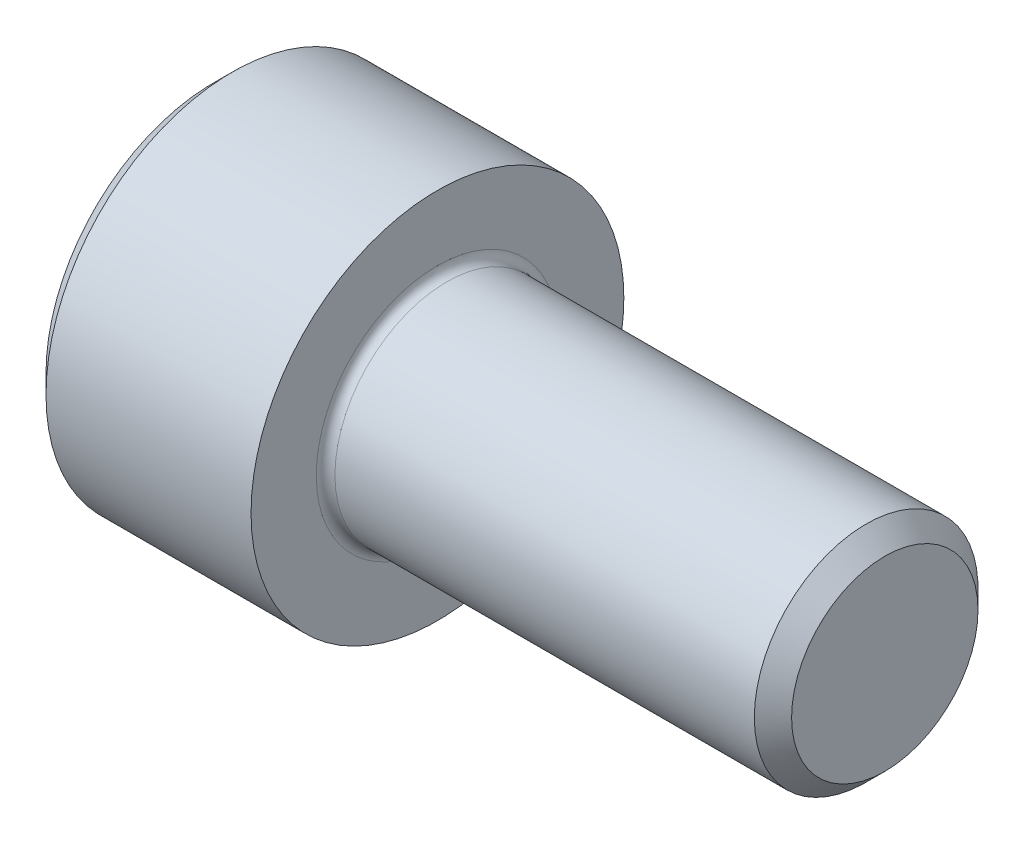
from build123d import *

# Parameters (mm, degrees)
CHAMFER1_SIZE      = 0.5
CUT_EXTRUDE1_DEPTH = 3


with BuildPart() as part:
    # Sketch1 → Revolve1 (revolve)
    with BuildSketch(Plane.XY, mode=Mode.PRIVATE) as revolve1_sk:
        with BuildLine():
            Line((0, 0), (0, 5))
            Line((0, 5), (6, 5))
            Line((6, 5), (6, 3.25))
            ThreePointArc((6, 3.25), (6.073223305, 3.073223305), (6.25, 3))
            Line((6.25, 3), (18, 3))
            Line((18, 3), (18, 0))
            Line((18, 0), (0, 0))
        make_face()
    revolve(revolve1_sk.sketch.rotate(Axis((0, 0, 0), (1, 0, 0)), 90), axis=Axis((0, 0, 0), (1, 0, 0)))

    # Chamfer1
    chamfer1_edges = [part.edges().sort_by_distance(p)[0] for p in [
        (0, 0, -5),
        (18, 0, -3),
    ]]
    chamfer(chamfer1_edges, length=CHAMFER1_SIZE)

    # Sketch2 → Cut-Extrude1 (cut)
    with BuildSketch(Plane.ZY):
        Polygon((0, -2.5), (2.165063509, -1.25), (2.165063509, 1.25), (0, 2.5), (-2.165063509, 1.25), (-2.165063509, -1.25), align=None)
    extrude(amount=-CUT_EXTRUDE1_DEPTH, mode=Mode.SUBTRACT)

    # Sketch3 → Cut-Revolve1 (revolve, cut)
    with BuildSketch(Plane.XY, mode=Mode.PRIVATE) as cut_revolve1_sk:
        Polygon((3, 2.5), (3, 0), (4.5, 0), align=None)
    revolve(cut_revolve1_sk.sketch.rotate(Axis((3, 0, 0), (1, 0, 0)), 270), axis=Axis((3, 0, 0), (1, 0, 0)), mode=Mode.SUBTRACT)


solid = part.part
